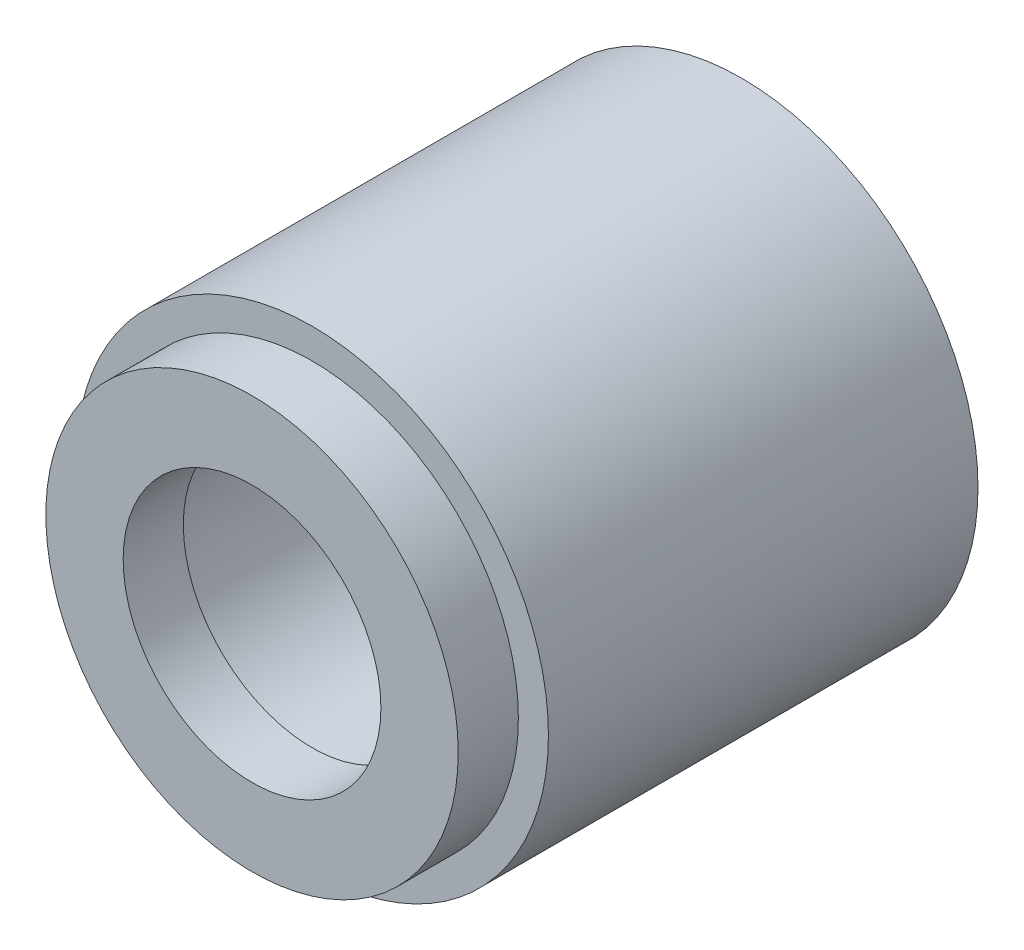
from build123d import *

# Parameters (mm, degrees)
SKETCH1_R           = 2.75
SKETCH1_R_2         = 1.6
BOSS_EXTRUDE1_DEPTH = 5
SKETCH2_R           = 2.4
SKETCH2_R_2         = 1.5
BOSS_EXTRUDE2_DEPTH = 0.7


with BuildPart() as part:
    # Sketch1 → Boss-Extrude1 (new body)
    with BuildSketch(Plane.XY):
        Circle(SKETCH1_R)
        Circle(SKETCH1_R_2, mode=Mode.SUBTRACT)
    extrude(amount=BOSS_EXTRUDE1_DEPTH)

    # Sketch2 → Boss-Extrude2 (add)
    with BuildSketch(Plane.XY.offset(5)):
        Circle(SKETCH2_R)
        Circle(SKETCH2_R_2, mode=Mode.SUBTRACT)
    extrude(amount=BOSS_EXTRUDE2_DEPTH)


solid = part.part
